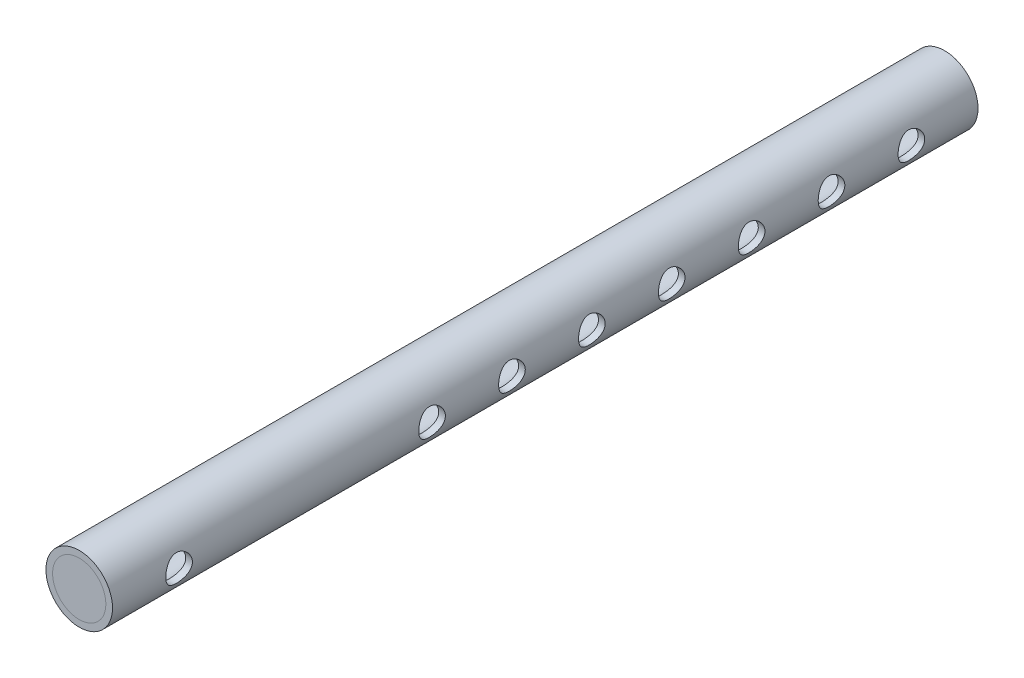
from build123d import *

# Parameters (mm, degrees)
SKETCH1_R           = 12.5
SKETCH1_R_2         = 10
BOSS_EXTRUDE1_DEPTH = 325
SKETCH2_R           = 10
BOSS_EXTRUDE2_DEPTH = 5
SKETCH3_R           = 5
CUT_EXTRUDE1_DEPTH  = 326.480414157
SKETCH4_R           = 5
CUT_EXTRUDE2_DEPTH  = 326.480414265
LPATTERN1_COUNT     = 7
LPATTERN1_PITCH     = 30


with BuildPart() as part:
    # Sketch1 → Boss-Extrude1 (new body)
    with BuildSketch(Plane.XY):
        Circle(SKETCH1_R)
        Circle(SKETCH1_R_2, mode=Mode.SUBTRACT)
    extrude(amount=BOSS_EXTRUDE1_DEPTH)

    # Sketch3 → Cut-Extrude1 (cut, through all)
    with BuildSketch(Plane(origin=(0, 0, 0), x_dir=(0, 0, -1), z_dir=(1, 0, 0))):
        with Locations(Location((-300, 0, 0), (0, 0, 180))):
            Circle(SKETCH3_R)
    extrude(amount=CUT_EXTRUDE1_DEPTH, mode=Mode.SUBTRACT)

    # Sketch4 → Cut-Extrude2 (cut, through all)
    with BuildSketch(Plane(origin=(0, 0, 0), x_dir=(0, 0, -1), z_dir=(1, 0, 0))):
        with Locations(Location((-205, 0, 0), (0, 0, 180))):
            Circle(SKETCH4_R)
    cut_extrude2 = extrude(amount=CUT_EXTRUDE2_DEPTH, mode=Mode.SUBTRACT)

    # LPattern1: Cut-Extrude2 ×7
    with Locations(*[(0, 0, -i * LPATTERN1_PITCH) for i in range(1, LPATTERN1_COUNT)]):
        add(cut_extrude2, mode=Mode.SUBTRACT)


with BuildPart() as body_2:
    # Sketch2 → Boss-Extrude2 (new body)
    with BuildSketch(Plane.XY.offset(325)):
        Circle(SKETCH2_R)
    extrude(amount=-BOSS_EXTRUDE2_DEPTH)


solid = Compound([part.part, body_2.part])
